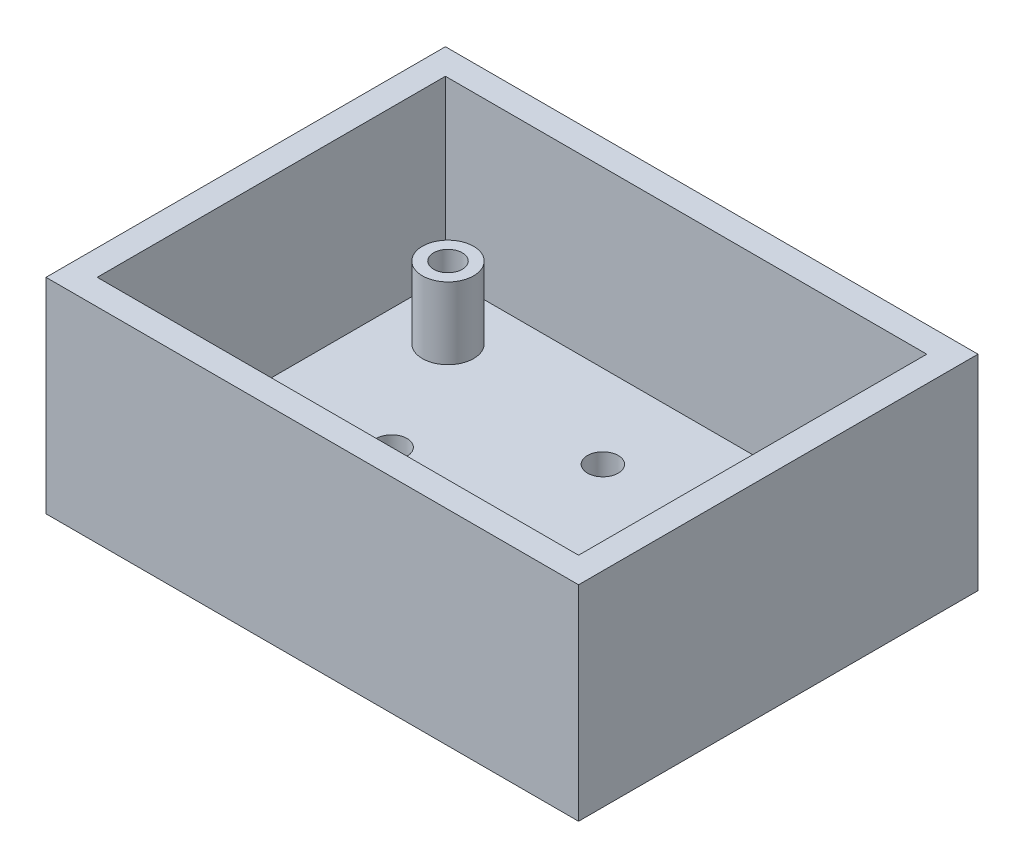
from build123d import *

# Parameters (mm, degrees)
SKETCH_1_W          = 52
SKETCH_1_H          = 39
SKETCH_1_W_2        = 47
SKETCH_1_H_2        = 34
EXTRUDE_1_DEPTH     = 20
SKETCH_2_R          = 2.5
EXTRUDE_2_DEPTH     = 10
EXTRUDE_2_2_DEPTH   = 10
EXTRUDE_2_3_DEPTH   = 10
EXTRUDE_2_4_DEPTH   = 10
SKETCH_3_R          = 1.4
CUT_EXTRUDE_1_DEPTH = 7
SKETCH_4_W          = 52
SKETCH_4_H          = 39
EXTRUDE_3_DEPTH     = 3
SKETCH_5_R          = 1.5
CUT_EXTRUDE_2_DEPTH = 37.67764987


with BuildPart() as part:
    # 草图1 → 凸台-拉伸1 (new body)
    with BuildSketch(Plane(origin=(0, 0, 0), x_dir=(1, 0, 0), z_dir=(0, 1, 0))):
        Rectangle(SKETCH_1_W, SKETCH_1_H)
        Rectangle(SKETCH_1_W_2, SKETCH_1_H_2, mode=Mode.SUBTRACT)
    extrude(amount=EXTRUDE_1_DEPTH)



with BuildPart() as body_2:
    # 草图2 → 凸台-拉伸2 (new body)
    with BuildSketch(Plane.XZ):
        with Locations(Location((-17.75, 11.5, 0), (0, 0, 270))):
            Circle(SKETCH_2_R)
    extrude(amount=-EXTRUDE_2_DEPTH)


with BuildPart() as body_3:
    # 草图2 → Extrude 2 2 (new body)
    with BuildSketch(Plane.XZ):
        with Locations(Location((17.75, 11.5, 0), (0, 0, 270))):
            Circle(SKETCH_2_R)
    extrude(amount=-EXTRUDE_2_2_DEPTH)


with BuildPart() as body_4:
    # 草图2 → Extrude 2 3 (new body)
    with BuildSketch(Plane.XZ):
        with Locations(Location((-17.75, -11.5, 0), (0, 0, 270))):
            Circle(SKETCH_2_R)
    extrude(amount=-EXTRUDE_2_3_DEPTH)


with BuildPart() as body_5:
    # 草图2 → Extrude 2 4 (new body)
    with BuildSketch(Plane.XZ):
        with Locations(Location((17.75, -11.5, 0), (0, 0, 270))):
            Circle(SKETCH_2_R)
    extrude(amount=-EXTRUDE_2_4_DEPTH)


with BuildPart() as cut_extrude_1_tool:
    # 草图3 → 切除-拉伸1 (new body)
    with BuildSketch(Plane(origin=(0, 10, 0), x_dir=(1, 0, 0), z_dir=(0, 1, 0))):
        with Locations(Location((-17.75, 11.5, 0), (0, 0, 270))):
            Circle(SKETCH_3_R)
        with Locations(Location((17.75, 11.5, 0), (0, 0, 270))):
            Circle(SKETCH_3_R)
        with Locations(Location((-17.75, -11.5, 0), (0, 0, 270))):
            Circle(SKETCH_3_R)
        with Locations(Location((17.75, -11.5, 0), (0, 0, 270))):
            Circle(SKETCH_3_R)
    extrude(amount=-CUT_EXTRUDE_1_DEPTH)


with BuildPart() as body_2_1:
    add(body_2.part)

    # 切除-拉伸1: cut by cut_extrude_1_tool
    add(cut_extrude_1_tool.part, mode=Mode.SUBTRACT)


with BuildPart() as body_3_1:
    add(body_3.part)

    # 切除-拉伸1: cut by cut_extrude_1_tool
    add(cut_extrude_1_tool.part, mode=Mode.SUBTRACT)


with BuildPart() as body_4_1:
    add(body_4.part)

    # 切除-拉伸1: cut by cut_extrude_1_tool
    add(cut_extrude_1_tool.part, mode=Mode.SUBTRACT)


with BuildPart() as body_5_1:
    add(body_5.part)

    # 切除-拉伸1: cut by cut_extrude_1_tool
    add(cut_extrude_1_tool.part, mode=Mode.SUBTRACT)


with BuildPart() as part_1:
    add(part.part)

    add(body_2_1.part)  # 凸台-拉伸3 merges body 2

    add(body_3_1.part)  # 凸台-拉伸3 merges body 3

    add(body_4_1.part)  # 凸台-拉伸3 merges body 4

    add(body_5_1.part)  # 凸台-拉伸3 merges body 5
    # 草图4 → 凸台-拉伸3 (add)
    with BuildSketch(Plane.XZ):
        Rectangle(SKETCH_4_W, SKETCH_4_H)
    extrude(amount=-EXTRUDE_3_DEPTH)

    # 草图5 → 切除-拉伸2 (cut, through all)
    with BuildSketch(Plane(origin=(0, 3, 0), x_dir=(1, 0, 0), z_dir=(0, 1, 0))):
        with Locations(Location((0, 8.872353491, 0), (0, 0, 270))):
            Circle(SKETCH_5_R)
        with Locations(Location((11.75, 0, 0), (0, 0, 270))):
            Circle(SKETCH_5_R)
        with Locations(Location((0, -8.872353491, 0), (0, 0, 90))):
            Circle(SKETCH_5_R)
        with Locations(Location((-11.75, 0, 0), (0, 0, 90))):
            Circle(SKETCH_5_R)
    extrude(amount=-CUT_EXTRUDE_2_DEPTH, mode=Mode.SUBTRACT)


solid = part_1.part
